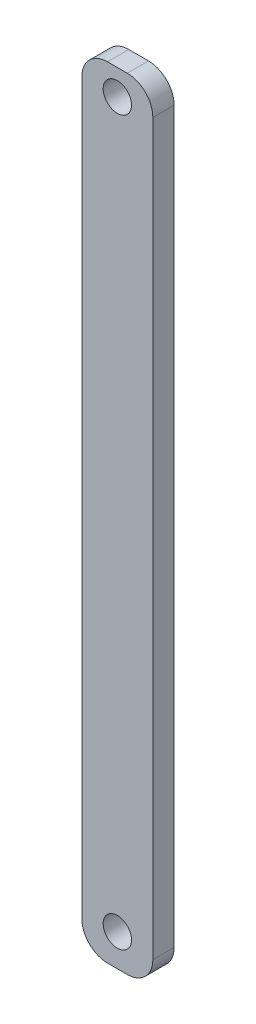
from build123d import *

# Parameters (mm, degrees)
SKETCH7_W           = 50
SKETCH7_H           = 550
BOSS_EXTRUDE1_DEPTH = 7.5
FILLET1_R           = 18
SKETCH8_R           = 10
CUT_EXTRUDE1_DEPTH  = 324.904692772
SKETCH9_R           = 10
CUT_EXTRUDE2_DEPTH  = 324.904692772


with BuildPart() as part:
    # Sketch7 → Boss-Extrude1 (new, symmetric)
    with BuildSketch(Plane.XY):
        with Locations((12.3, -46.4)):
            Rectangle(SKETCH7_W, SKETCH7_H)
    extrude(amount=BOSS_EXTRUDE1_DEPTH, both=True)

    # Fillet1
    fillet1_edges = [part.edges().sort_by_distance(p)[0] for p in [
        (-12.7, 228.6, 0),
        (37.3, 228.6, 0),
        (37.3, -321.4, 0),
        (-12.7, -321.4, 0),
    ]]
    fillet(fillet1_edges, radius=FILLET1_R)

    # Sketch8 → Cut-Extrude1 (cut, through all)
    with BuildSketch(Plane.XY.offset(7.5)):
        with Locations((12.3, 210.6)):
            Circle(SKETCH8_R)
    extrude(amount=-CUT_EXTRUDE1_DEPTH, mode=Mode.SUBTRACT)

    # Sketch9 → Cut-Extrude2 (cut, through all)
    with BuildSketch(Plane.XY.offset(7.5)):
        with Locations((12.3, -298.842314327)):
            Circle(SKETCH9_R)
    extrude(amount=-CUT_EXTRUDE2_DEPTH, mode=Mode.SUBTRACT)


solid = part.part
